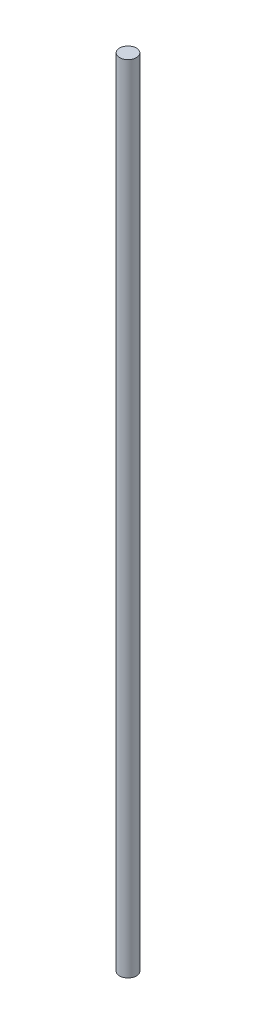
from build123d import *

# Parameters (mm, degrees)
SKETCH1_R           = 2
BOSS_EXTRUDE1_DEPTH = 190


with BuildPart() as part:
    # Sketch1 → Boss-Extrude1 (new body)
    with BuildSketch(Plane(origin=(0, 0, 0), x_dir=(1, 0, 0), z_dir=(0, 1, 0))):
        with Locations(Location((0, 0, 0), (0, 0, 270))):
            Circle(SKETCH1_R)
    extrude(amount=BOSS_EXTRUDE1_DEPTH)


solid = part.part
